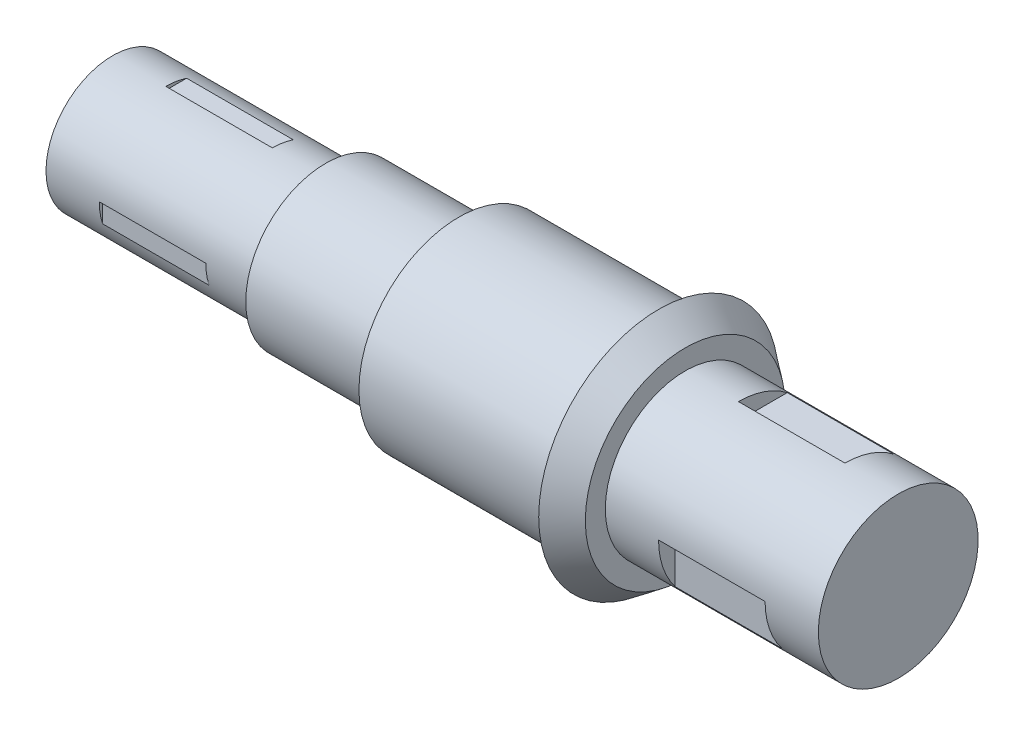
from build123d import *

# Parameters (mm, degrees)
SKETCH2_W                     = 8
SKETCH2_H                     = 10.25
CUT_FLATS_TOP_BOT_LEFT_DEPTH  = 30
SKETCH3_W                     = 8
SKETCH3_H                     = 10.25
CUT_FLATS_SIDES_LEFT_DEPTH    = 30
SKETCH4_W                     = 8
SKETCH4_H                     = 10.25
CUT_FLATS_TOP_BOT_RIGHT_DEPTH = 30
SKETCH5_W                     = 8
SKETCH5_H                     = 10.25
CUT_FLATS_SIDES_RIGHT_DEPTH   = 30


with BuildPart() as part:
    # Sketch1 → Revolve-Shaft (revolve)
    with BuildSketch(Plane.XY, mode=Mode.PRIVATE) as revolve_shaft_sk:
        Polygon((0, 0), (0, 5), (16, 5), (16, 6), (26, 6), (26, 7.5), (41, 7.5), (41, 9), (43, 7.5), (43, 6), (59, 6), (59, 0), align=None)
    revolve(revolve_shaft_sk.sketch.rotate(Axis((0, 0, 0), (1, 0, 0)), 90), axis=Axis((0, 0, 0), (1, 0, 0)))

    # Sketch2 → Cut-Flats Top-Bot Left (cut)
    with BuildSketch(Plane(origin=(0, 0, 0), x_dir=(1, 0, 0), z_dir=(0, 1, 0))):
        with Locations((8, 9.875)):
            Rectangle(SKETCH2_W, SKETCH2_H)
        with Locations((8, -9.875)):
            Rectangle(SKETCH2_W, SKETCH2_H)
    extrude(amount=-CUT_FLATS_TOP_BOT_LEFT_DEPTH, mode=Mode.SUBTRACT)

    # Sketch3 → Cut-Flats Sides Left (cut)
    with BuildSketch(Plane.XY):
        with Locations((8, 9.875)):
            Rectangle(SKETCH3_W, SKETCH3_H)
        with Locations((8, -9.875)):
            Rectangle(SKETCH3_W, SKETCH3_H)
    extrude(amount=-CUT_FLATS_SIDES_LEFT_DEPTH, mode=Mode.SUBTRACT)

    # Sketch4 → Cut-Flats Top-Bot Right (cut)
    with BuildSketch(Plane(origin=(0, 0, 0), x_dir=(1, 0, 0), z_dir=(0, 1, 0))):
        with Locations((51, 9.875)):
            Rectangle(SKETCH4_W, SKETCH4_H)
        with Locations((51, -9.875)):
            Rectangle(SKETCH4_W, SKETCH4_H)
    extrude(amount=-CUT_FLATS_TOP_BOT_RIGHT_DEPTH, mode=Mode.SUBTRACT)

    # Sketch5 → Cut-Flats Sides Right (cut)
    with BuildSketch(Plane.XY):
        with Locations((51, 9.875)):
            Rectangle(SKETCH5_W, SKETCH5_H)
        with Locations((51, -9.875)):
            Rectangle(SKETCH5_W, SKETCH5_H)
    extrude(amount=-CUT_FLATS_SIDES_RIGHT_DEPTH, mode=Mode.SUBTRACT)


solid = part.part
